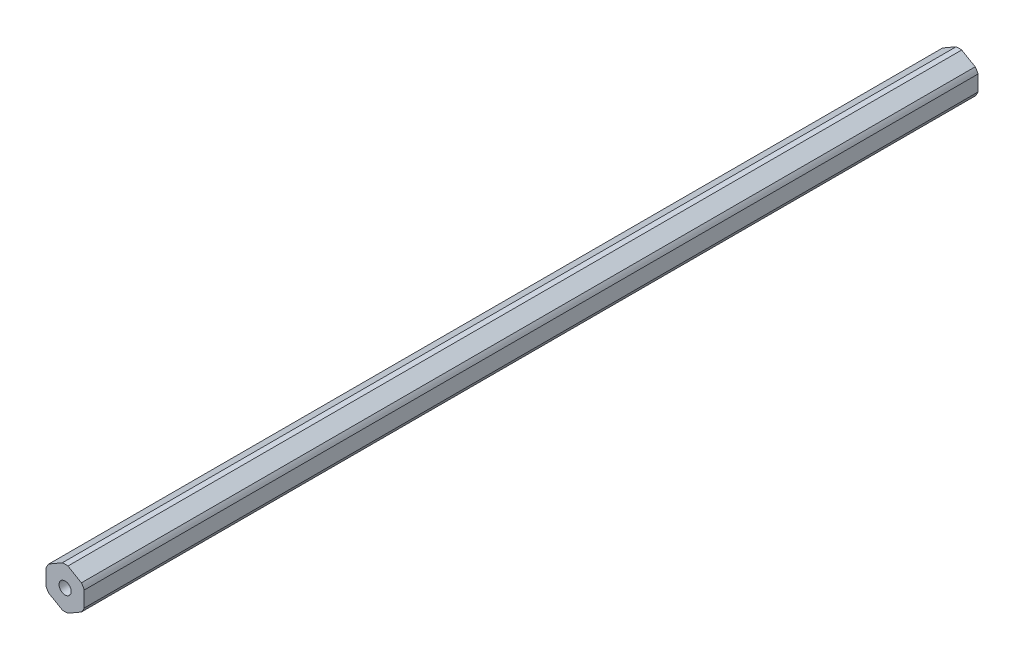
from build123d import *

# Parameters (mm, degrees)
BOSS_EXTRUDE1_DEPTH = 148.5265
SKETCH2_R           = 2.0193
CUT_EXTRUDE1_DEPTH  = 298.199999113


with BuildPart() as part:
    # Sketch1 → Boss-Extrude1 (new, symmetric)
    with BuildSketch(Plane.XY):
        with BuildLine():
            ThreePointArc((0.93173274, 6.79441227), (0, 6.858), (-0.93173274, 6.79441227))
            Line((-0.93173274, 6.79441227), (-5.41826726, 4.204110358))
            ThreePointArc((-5.41826726, 4.204110358), (-5.939202219, 3.429), (-6.35, 2.590301913))
            Line((-6.35, 2.590301913), (-6.35, -2.590301913))
            ThreePointArc((-6.35, -2.590301913), (-5.939202219, -3.429), (-5.41826726, -4.204110358))
            Line((-5.41826726, -4.204110358), (-0.93173274, -6.79441227))
            ThreePointArc((-0.93173274, -6.79441227), (0, -6.858), (0.93173274, -6.79441227))
            Line((0.93173274, -6.79441227), (5.41826726, -4.204110358))
            ThreePointArc((5.41826726, -4.204110358), (5.939202219, -3.429), (6.35, -2.590301913))
            Line((6.35, -2.590301913), (6.35, 2.590301913))
            ThreePointArc((6.35, 2.590301913), (5.939202219, 3.429), (5.41826726, 4.204110358))
            Line((5.41826726, 4.204110358), (0.93173274, 6.79441227))
        make_face()
    extrude(amount=BOSS_EXTRUDE1_DEPTH, both=True)

    # Sketch2 → Cut-Extrude1 (cut, through all)
    with BuildSketch(Plane.XY.offset(148.5265)):
        Circle(SKETCH2_R)
    extrude(amount=-CUT_EXTRUDE1_DEPTH, mode=Mode.SUBTRACT)


solid = part.part
